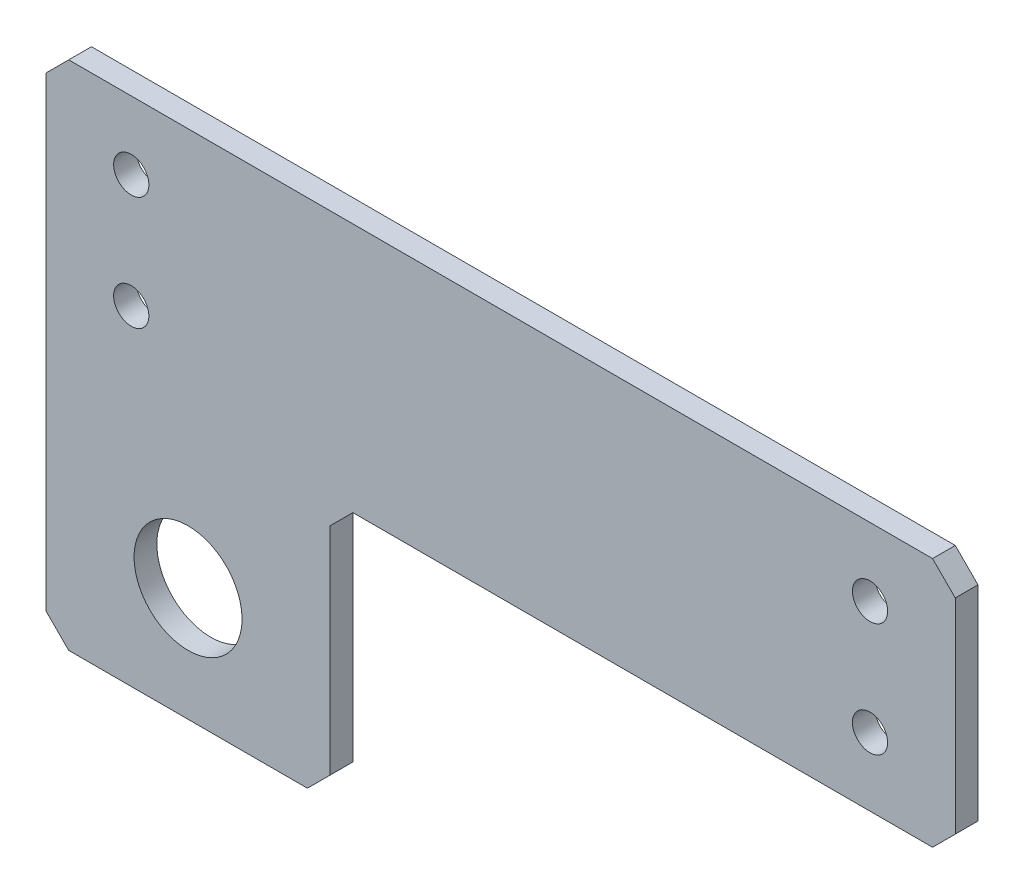
from build123d import *

# Parameters (mm, degrees)
SKETCH_1_W                  = 160
SKETCH_1_H                  = 80
EXTRUDE_1_DEPTH             = 4
SKETCH_2_R                  = 3.1
CUT_EXTRUDE_1_DEPTH         = 90.532117142
PATTERN_LINEAR_1_COUNT      = 2
PATTERN_LINEAR_1_PITCH      = 20
PATTERN_LINEAR_1_COUNT_DIR2 = 2
PATTERN_LINEAR_1_PITCH_DIR2 = 130
SKETCH_3_W                  = 110
SKETCH_3_H                  = 36
CUT_EXTRUDE_2_DEPTH         = 90.532117142
SKETCH_4_W                  = 50
SKETCH_4_H                  = 4
EXTRUDE_2_DEPTH             = 10
CHAMFER_1_SIZE              = 4
SKETCH_5_R                  = 9.5
CUT_EXTRUDE_3_DEPTH         = 95.424573073


with BuildPart() as part:
    # 草圖1 → 填料-伸長1 (new body)
    with BuildSketch(Plane.XY):
        Rectangle(SKETCH_1_W, SKETCH_1_H)
    extrude(amount=EXTRUDE_1_DEPTH)

    # 草圖2 → 除料-伸長1 (cut, through all)
    with BuildSketch(Plane.XY.offset(4)):
        with Locations((65, 28)):
            Circle(SKETCH_2_R)
    cut_extrude_1 = extrude(amount=-CUT_EXTRUDE_1_DEPTH, mode=Mode.SUBTRACT)

    # 直線複製排列1: Cut-Extrude 1 2 × 2
    with Locations(*[(-j * PATTERN_LINEAR_1_PITCH_DIR2, -i * PATTERN_LINEAR_1_PITCH, 0) for i in range(PATTERN_LINEAR_1_COUNT) for j in range(PATTERN_LINEAR_1_COUNT_DIR2) if (i, j) != (0, 0)]):
        add(cut_extrude_1, mode=Mode.SUBTRACT)

    # 草圖3 → 除料-伸長2 (cut, through all)
    with BuildSketch(Plane.XY.offset(4)):
        with Locations((25, -22)):
            Rectangle(SKETCH_3_W, SKETCH_3_H)
    extrude(amount=-CUT_EXTRUDE_2_DEPTH, mode=Mode.SUBTRACT)

    # 草圖4 → 填料-伸長2 (add)
    with BuildSketch(Plane.XZ.offset(40)):
        with Locations((-55, 2)):
            Rectangle(SKETCH_4_W, SKETCH_4_H)
    extrude(amount=EXTRUDE_2_DEPTH)

    # 導角1
    chamfer_1_edges = [part.edges().sort_by_distance(p)[0] for p in [
        (80, -4, 2),
        (-30, -4, 2),
        (-80, -50, 2),
        (-30, -50, 2),
        (-80, 40, 2),
        (80, 40, 2),
    ]]
    chamfer(chamfer_1_edges, length=CHAMFER_1_SIZE)

    # 草圖5 → 除料-伸長3 (cut, through all)
    with BuildSketch(Plane.XY.offset(4)):
        with Locations((-55, -30)):
            Circle(SKETCH_5_R)
    extrude(amount=-CUT_EXTRUDE_3_DEPTH, mode=Mode.SUBTRACT)


solid = part.part
